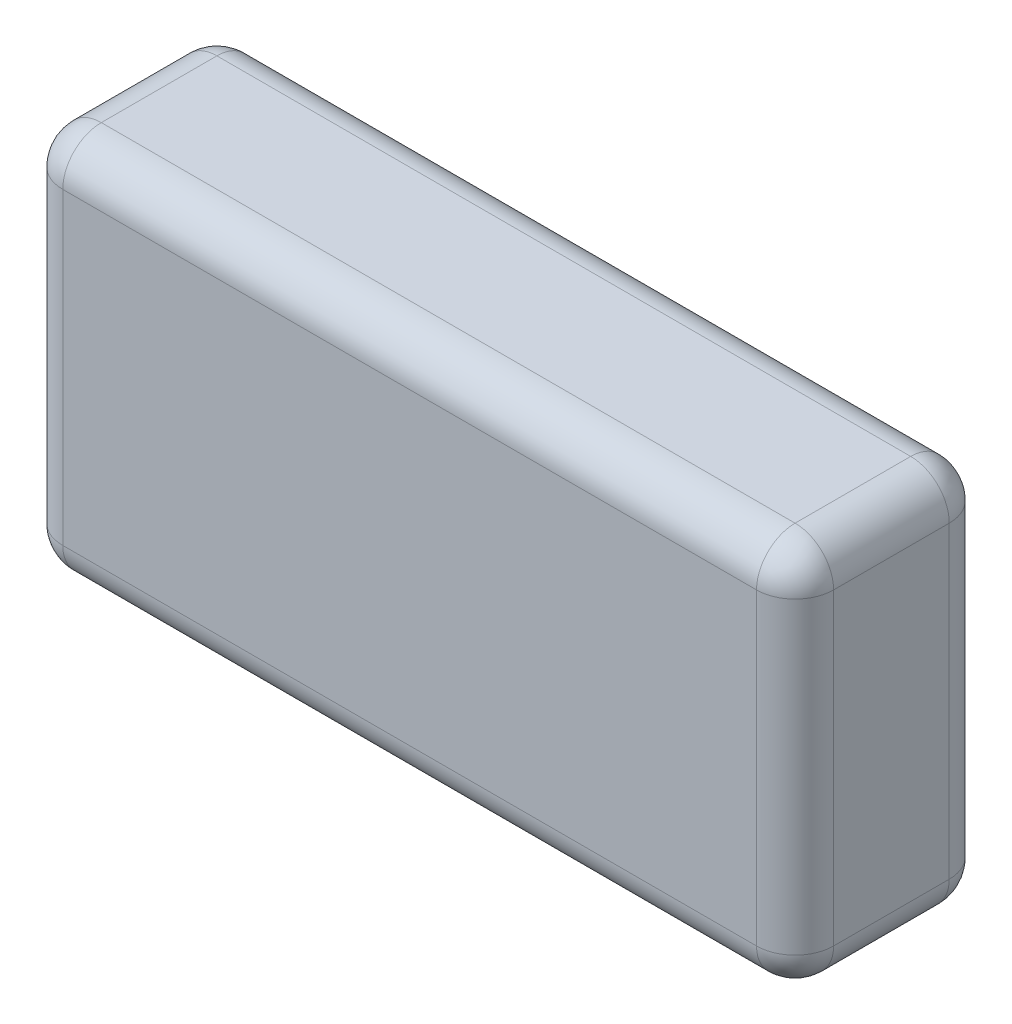
from build123d import *

# Parameters (mm, degrees)
ESBO_O1_W                = 200
ESBO_O1_H                = 50
RESSALTO_EXTRUS_O1_DEPTH = 100
FILETE9_R                = 10


with BuildPart() as part:
    # Esboço1 → Ressalto-extrusão1 (new body)
    with BuildSketch(Plane(origin=(0, 0, 0), x_dir=(1, 0, 0), z_dir=(0, 1, 0))):
        with Locations((45.947958133, -1.570526198)):
            Rectangle(ESBO_O1_W, ESBO_O1_H)
    extrude(amount=RESSALTO_EXTRUS_O1_DEPTH)

    # Filete9
    filete9_edges = [part.edges().sort_by_distance(p)[0] for p in [
        (145.947958133, 100, 1.570526198),
        (45.947958133, 100, -23.429473802),
        (-54.052041867, 100, 1.570526198),
        (45.947958133, 0, -23.429473802),
        (145.947958133, 0, 1.570526198),
        (45.947958133, 0, 26.570526198),
        (-54.052041867, 0, 1.570526198),
        (45.947958133, 100, 26.570526198),
        (-54.052041867, 50, -23.429473802),
        (145.947958133, 50, -23.429473802),
        (145.947958133, 50, 26.570526198),
        (-54.052041867, 50, 26.570526198),
    ]]
    fillet(filete9_edges, radius=FILETE9_R)


solid = part.part
